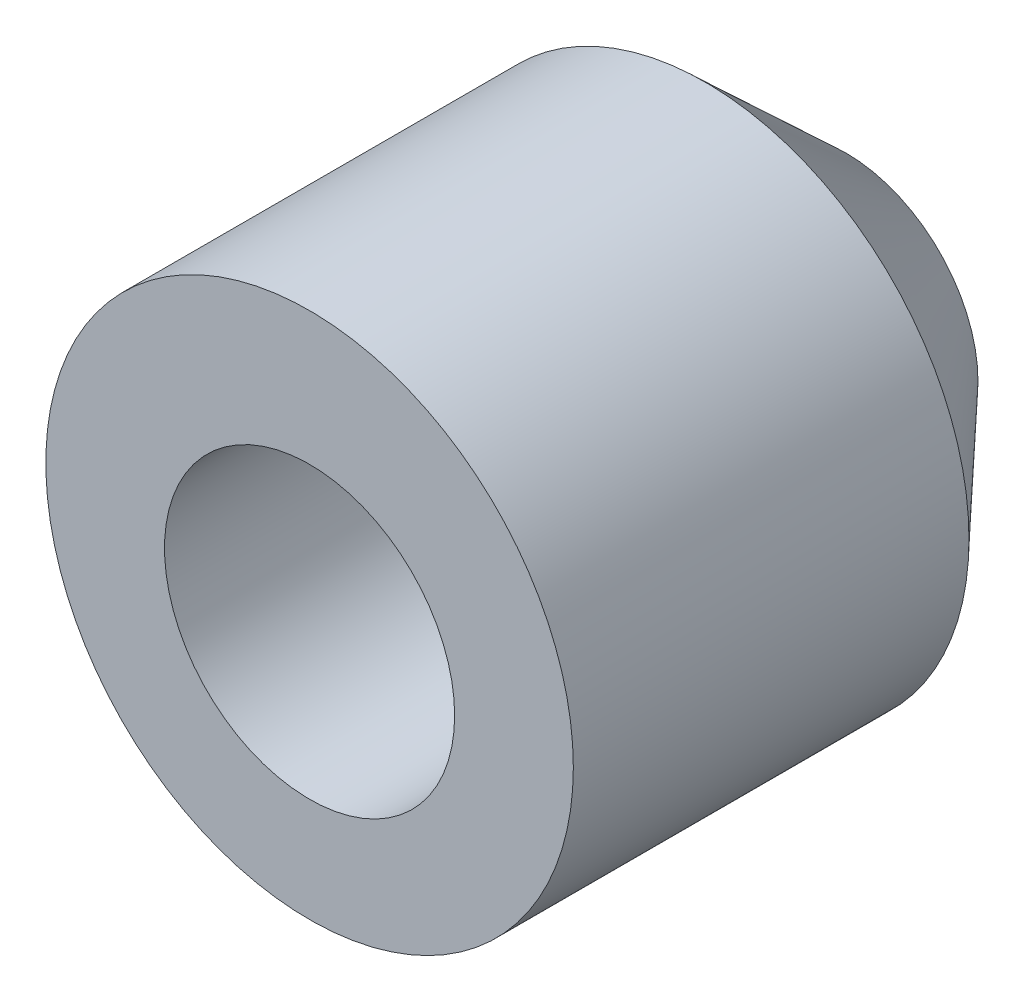
from build123d import *

# Parameters (mm, degrees)
SKETCH3_R          = 5.5
CUT_EXTRUDE1_DEPTH = 10


with BuildPart() as part:
    # Sketch2 → Revolve3 (revolve)
    with BuildSketch(Plane(origin=(0, 0, 0), x_dir=(0, 0, -1), z_dir=(1, 0, 0)), mode=Mode.PRIVATE) as revolve3_sk:
        Polygon((0, -1.803874092), (0, 8.196125908), (15, 8.196125908), (20.341527599, 3.196125908), (15, -1.803874092), align=None)
    revolve(revolve3_sk.sketch.rotate(Axis((0, 8.196125908, 0), (0, 0, -1)), 270), axis=Axis((0, 8.196125908, 0), (0, 0, -1)))

    # Sketch3 → Cut-Extrude1 (cut)
    with BuildSketch(Plane.XY):
        with Locations((0, 7.647443929)):
            Circle(SKETCH3_R)
    extrude(amount=-CUT_EXTRUDE1_DEPTH, mode=Mode.SUBTRACT)


solid = part.part
